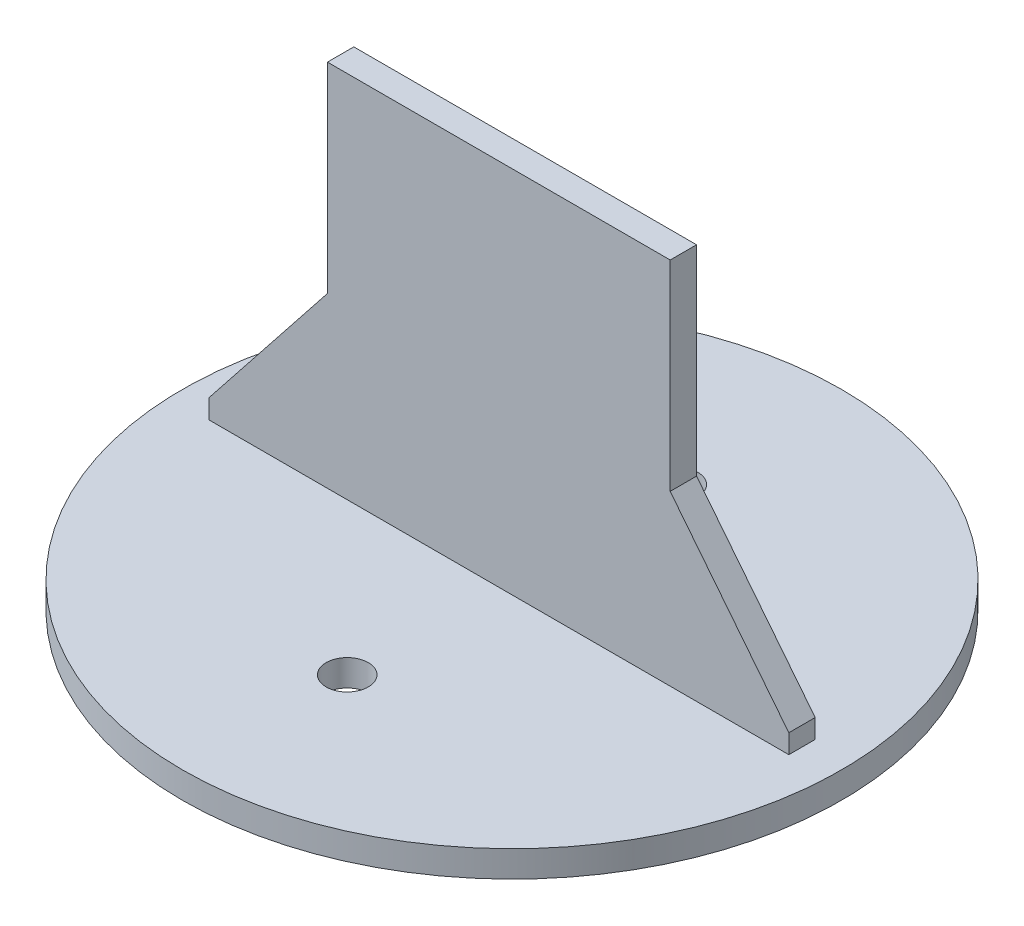
from build123d import *

# Parameters (mm, degrees)
SKETCH1_R           = 12.5
SKETCH1_R_2         = 0.8
BOSS_EXTRUDE1_DEPTH = 1
BOSS_EXTRUDE2_DEPTH = 0.5


with BuildPart() as part:
    # Sketch1 → Boss-Extrude1 (new body)
    with BuildSketch(Plane(origin=(0, 0, 0), x_dir=(1, 0, 0), z_dir=(0, 1, 0))):
        with Locations(Location((0, 0, 0), (0, 0, 270))):
            Circle(SKETCH1_R)
        with Locations(Location((0, 6.25, 0), (0, 0, 270))):
            Circle(SKETCH1_R_2, mode=Mode.SUBTRACT)
        with Locations(Location((0, -6.25, 0), (0, 0, 270))):
            Circle(SKETCH1_R_2, mode=Mode.SUBTRACT)
    extrude(amount=-BOSS_EXTRUDE1_DEPTH)

    # Sketch2 → Boss-Extrude2 (add, symmetric)
    with BuildSketch(Plane.XY):
        Polygon((-11, 0), (-11, 0.721206206), (-6.5, 6.4), (-6.5, 14), (6.5, 14), (6.5, 6.4), (11, 0.721206206), (11, 0), align=None)
    extrude(amount=BOSS_EXTRUDE2_DEPTH, both=True)


solid = part.part
